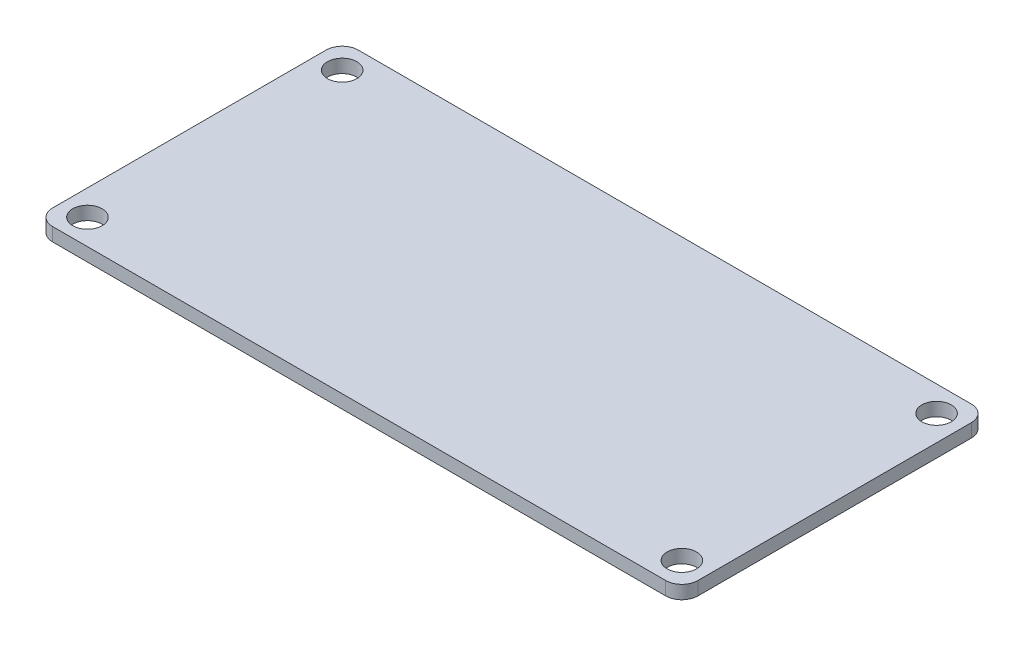
from build123d import *

# Parameters (mm, degrees)
SKETCH1_W               = 48.26
SKETCH1_H               = 22.86
BOSS_EXTRUDE1_DEPTH     = 1
CUT_EXTRUDE1_DEPTH      = 54.409804343
CUT_EXTRUDE1_DEPTH_BACK = 54.409804343
SKETCH2_R               = 1.09982
FILLET1_R               = 1.2065
SKETCH3_W               = 6.1
SKETCH3_H               = 8
BOSS_EXTRUDE2_DEPTH     = 3.5


with BuildPart() as part:
    # Sketch1 → Boss-Extrude1 (new body)
    with BuildSketch(Plane(origin=(0, 0, 0), x_dir=(1, 0, 0), z_dir=(0, 1, 0))):
        with Locations((24.13, 11.43)):
            Rectangle(SKETCH1_W, SKETCH1_H)
    extrude(amount=BOSS_EXTRUDE1_DEPTH)

    # Sketch2 → Cut-Extrude1 (cut, two sides: drawn at the far end of the back side and taken through both)
    with BuildSketch(Plane(origin=(0, 1, 0), x_dir=(1, 0, 0), z_dir=(0, 1, 0)).offset(-CUT_EXTRUDE1_DEPTH_BACK)):
        with Locations(Location((1.905, 20.955, 0), (0, 0, 270))):
            Circle(SKETCH2_R)
        with Locations(Location((1.905, 1.905, 0), (0, 0, 270))):
            Circle(SKETCH2_R)
        with Locations(Location((46.355, 1.905, 0), (0, 0, 270))):
            Circle(SKETCH2_R)
        with Locations(Location((46.355, 20.955, 0), (0, 0, 270))):
            Circle(SKETCH2_R)
    extrude(amount=CUT_EXTRUDE1_DEPTH + CUT_EXTRUDE1_DEPTH_BACK, mode=Mode.SUBTRACT)

    # Fillet1
    fillet1_edges = [part.edges().sort_by_distance(p)[0] for p in [
        (0, 0.5, -22.86),
        (48.26, 0.5, -22.86),
        (48.26, 0.5, 0),
        (0, 0.5, 0),
    ]]
    fillet(fillet1_edges, radius=FILLET1_R)

    # Sketch3 → Boss-Extrude2 (add)
    with BuildSketch(Plane.XZ):
        with Locations((2.05, -11.43)):
            Rectangle(SKETCH3_W, SKETCH3_H)
    extrude(amount=BOSS_EXTRUDE2_DEPTH)


solid = part.part
